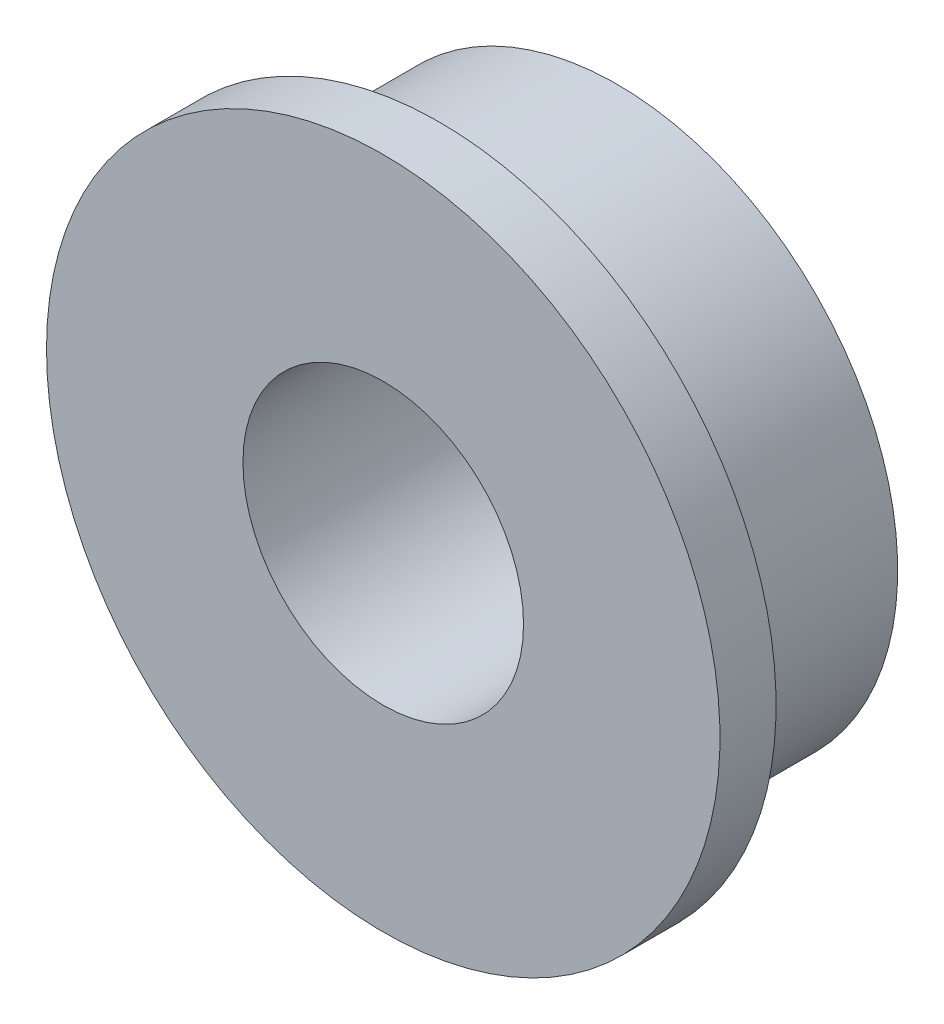
from build123d import *


with BuildPart() as part:
    # 草图1 → 旋转1 (revolve)
    with BuildSketch(Plane(origin=(0, 0, 0), x_dir=(1, 0, 0), z_dir=(0, 1, 0)), mode=Mode.PRIVATE) as revolve_1_sk:
        Polygon((1.5, 0), (1.5, 2.5), (3, 2.5), (3, 0.6), (3.6, 0.6), (3.6, 0), align=None)
    revolve(revolve_1_sk.sketch.rotate(Axis((0, 0, -3), (0, 0, 1)), 180), axis=Axis((0, 0, -3), (0, 0, 1)))


solid = part.part
